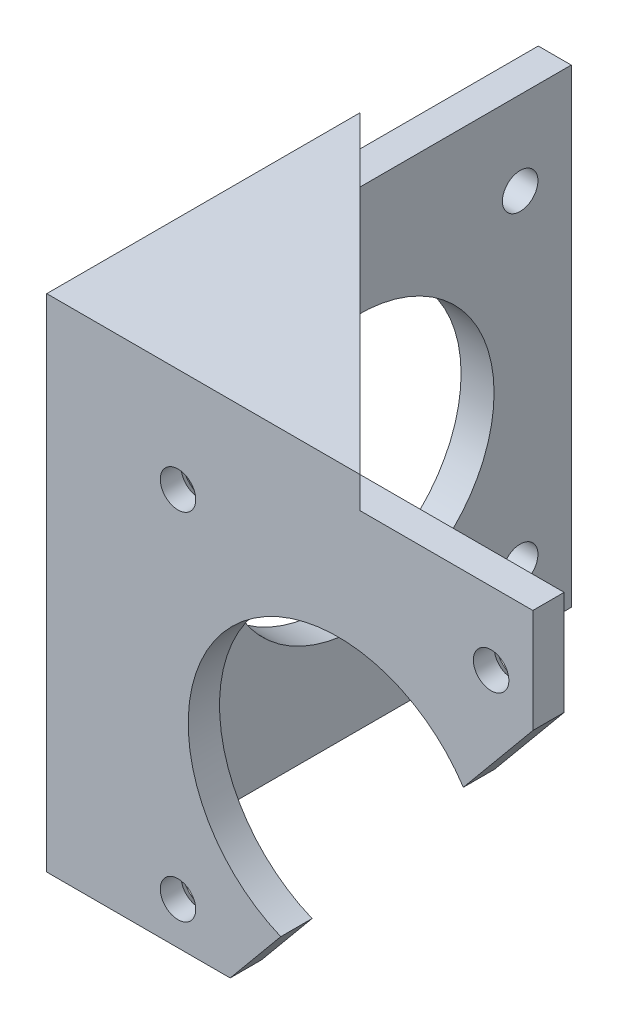
from build123d import *

# Parameters (mm, degrees)
SKETCH_1_R          = 1.7
EXTRUDE_1_DEPTH     = 3
SKETCH_2_W          = 3.161086378
SKETCH_2_H          = 42
EXTRUDE_2_DEPTH     = 45
SKETCH_3_R          = 1.7
SKETCH_3_R_2        = 13
CUT_EXTRUDE_1_DEPTH = 45
SKETCH_4_R          = 14.357158039
CUT_EXTRUDE_2_DEPTH = 5
SKETCH_5_W          = 3.756135355
SKETCH_5_H          = 42.889588607
CUT_EXTRUDE_3_DEPTH = 5
CHAMFER_1_SIZE      = 1
EXTRUDE_3_DEPTH     = 3
EXTRUDE_4_DEPTH     = 3


with BuildPart() as part:
    # Эскиз1 → Бобышка-Вытянуть1 (new body)
    with BuildSketch(Plane.XY):
        Polygon((34, 31), (34, 34), (34, 37.963249048), (-1.7, 37.963249048), (-6, 37.963249048), (-12.575968026, 37.963249048), (-12.575968026, -4.036750952), (-6, -4.036750952), (5, -4.036750952), align=None)
        Circle(SKETCH_1_R, mode=Mode.SUBTRACT)
        with Locations((0, 34)):
            Circle(SKETCH_1_R, mode=Mode.SUBTRACT)
        with Locations((30, 34)):
            Circle(SKETCH_1_R, mode=Mode.SUBTRACT)
    extrude(amount=EXTRUDE_1_DEPTH)

    # Эскиз2 → Бобышка-Вытянуть2 (add)
    with BuildSketch(Plane(origin=(0, 0, 0), x_dir=(-1, 0, 0), z_dir=(0, 0, -1))):
        with Locations((10.995424837, 16.963249048)):
            Rectangle(SKETCH_2_W, SKETCH_2_H)
    extrude(amount=EXTRUDE_2_DEPTH)

    # Эскиз3 → Вырез-Вытянуть1 (cut)
    with BuildSketch(Plane(origin=(-9.414881648, 0, 0), x_dir=(0, 0, -1), z_dir=(1, 0, 0))):
        with Locations((8.2, 32.963249048)):
            Circle(SKETCH_3_R)
        with Locations((8.2, 1.963249048)):
            Circle(SKETCH_3_R)
        with Locations((39.2, 1.963249048)):
            Circle(SKETCH_3_R)
        with Locations((39.2, 32.963249048)):
            Circle(SKETCH_3_R)
        with Locations((23.7, 17.463249048)):
            Circle(SKETCH_3_R_2)
    extrude(amount=-CUT_EXTRUDE_1_DEPTH, mode=Mode.SUBTRACT)

    # Эскиз4 → Вырез-Вытянуть2 (cut)
    with BuildSketch(Plane(origin=(0, 0, 0), x_dir=(-1, 0, 0), z_dir=(0, 0, -1))):
        with Locations((-15.336156096, 15.085397016)):
            Circle(SKETCH_4_R)
    extrude(amount=-CUT_EXTRUDE_2_DEPTH, mode=Mode.SUBTRACT)

    # Эскиз5 → Вырез-Вытянуть3 (cut)
    with BuildSketch(Plane(origin=(-9.414881648, 0, 0), x_dir=(0, 0, -1), z_dir=(1, 0, 0))):
        with Locations((45.97241361, 16.518454745)):
            Rectangle(SKETCH_5_W, SKETCH_5_H)
    extrude(amount=-CUT_EXTRUDE_3_DEPTH, mode=Mode.SUBTRACT)

    # Фаска1
    chamfer_1_edges = [part.edges().sort_by_distance(p)[0] for p in [
        (28.3, 34, 0),
        (-1.7, 34, 0),
        (-1.7, 0, 0),
    ]]
    chamfer(chamfer_1_edges, length=CHAMFER_1_SIZE)

    # Эскиз6 → Бобышка-Вытянуть3 (add)
    with BuildSketch(Plane(origin=(0, 37.963249048, 0), x_dir=(1, 0, 0), z_dir=(0, 1, 0))):
        Polygon((34, -3), (34, 0), (-9.414881648, 0), (-9.414881648, 44.094345932), (-12.575968026, 44.094345932), (-12.575968026, -3), align=None)
    extrude(amount=EXTRUDE_3_DEPTH)

    # Эскиз7 → Бобышка-Вытянуть4 (add)
    with BuildSketch(Plane(origin=(0, 40.963249048, 0), x_dir=(1, 0, 0), z_dir=(0, 1, 0))):
        Polygon((17.424031974, -3), (-12.575968026, -3), (-12.575968026, 27), align=None)
    extrude(amount=EXTRUDE_4_DEPTH)


solid = part.part
